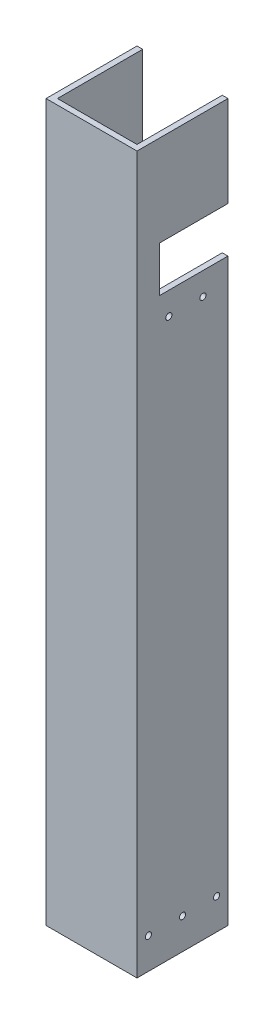
from build123d import *

# Parameters (mm, degrees)
BOSS_EXTRUDE1_DEPTH           = 400
SKETCH2_W                     = 3.175
SKETCH2_H                     = 25.4
CUT_EXTRUDE1_DEPTH            = 38.1
TAP_DRILL_FOR_8_32_TAP1_D     = 3.4544
TAP_DRILL_FOR_8_32_TAP2_D     = 3.4544
TAP_DRILL_FOR_8_32_TAP2_DEPTH = 3.175


with BuildPart() as part:
    # Sketch1 → Boss-Extrude1 (new body)
    with BuildSketch(Plane(origin=(0, 0, 0), x_dir=(1, 0, 0), z_dir=(0, 1, 0))):
        Polygon((0, 0), (0, -50.8), (50.8, -50.8), (50.8, 0), (47.625, 0), (47.625, -47.625), (3.175, -47.625), (3.175, 0), align=None)
    extrude(amount=BOSS_EXTRUDE1_DEPTH)

    # Sketch2 → Cut-Extrude1 (cut)
    with BuildSketch(Plane(origin=(0, 0, 0), x_dir=(-1, 0, 0), z_dir=(0, 0, -1))):
        with Locations((-49.2125, 336.5)):
            Rectangle(SKETCH2_W, SKETCH2_H)
    extrude(amount=-CUT_EXTRUDE1_DEPTH, mode=Mode.SUBTRACT)

    # Tap Drill for #8-32 Tap1 (through all)
    with Locations(Plane(origin=(50.8, 0, 0), x_dir=(0, 0, -1), z_dir=(1, 0, 0))):
        with Locations((-44.45, 17.3), (-25.4, 17.3), (-6.35, 17.3)):
            Hole(TAP_DRILL_FOR_8_32_TAP1_D / 2)

    # Tap Drill for #8-32 Tap2
    with Locations(Plane(origin=(50.8, 0, 0), x_dir=(0, 0, -1), z_dir=(1, 0, 0))):
        with Locations((-33.02, 311.1), (-13.97, 311.1)):
            Hole(TAP_DRILL_FOR_8_32_TAP2_D / 2, depth=TAP_DRILL_FOR_8_32_TAP2_DEPTH)


solid = part.part
